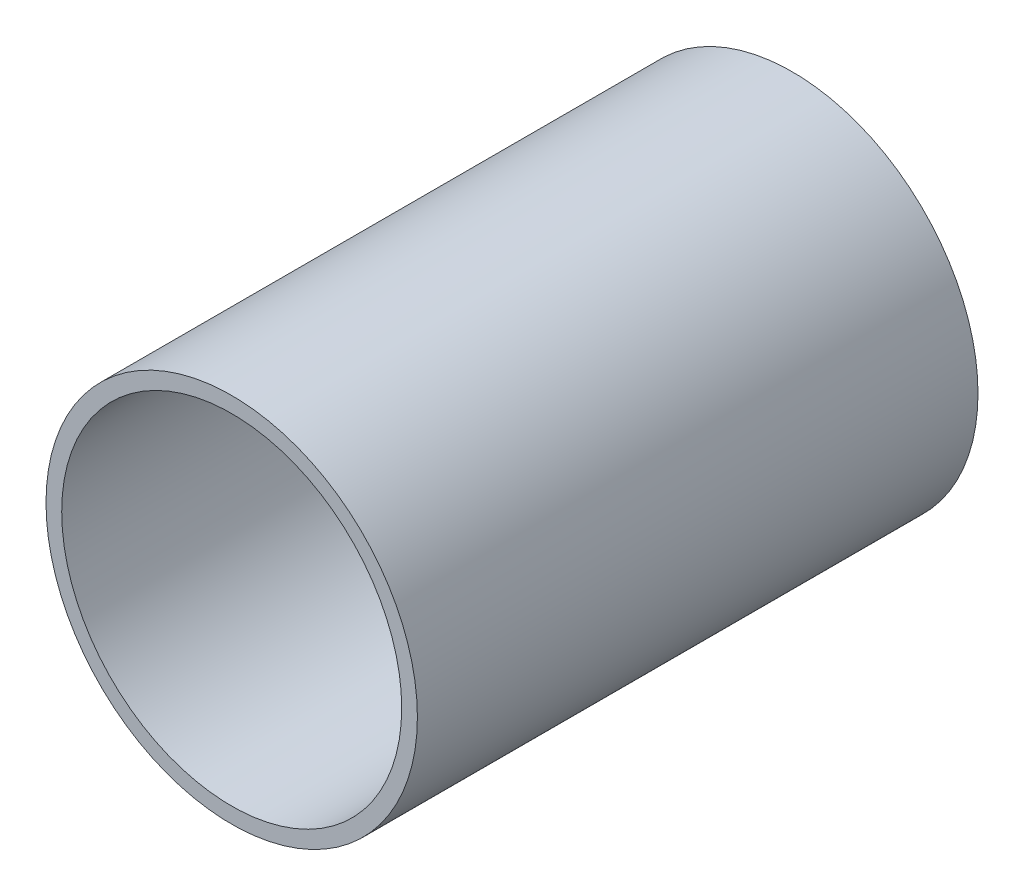
from build123d import *

# Parameters (mm, degrees)
SKETCH1_R      = 84.1375
SKETCH1_R_2    = 77.0255
BASEPIPE_DEPTH = 127


with BuildPart() as part:
    # Sketch1 → BasePipe (new, symmetric)
    with BuildSketch(Plane.XY):
        Circle(SKETCH1_R)
        Circle(SKETCH1_R_2, mode=Mode.SUBTRACT)
    extrude(amount=BASEPIPE_DEPTH, both=True)


solid = part.part
